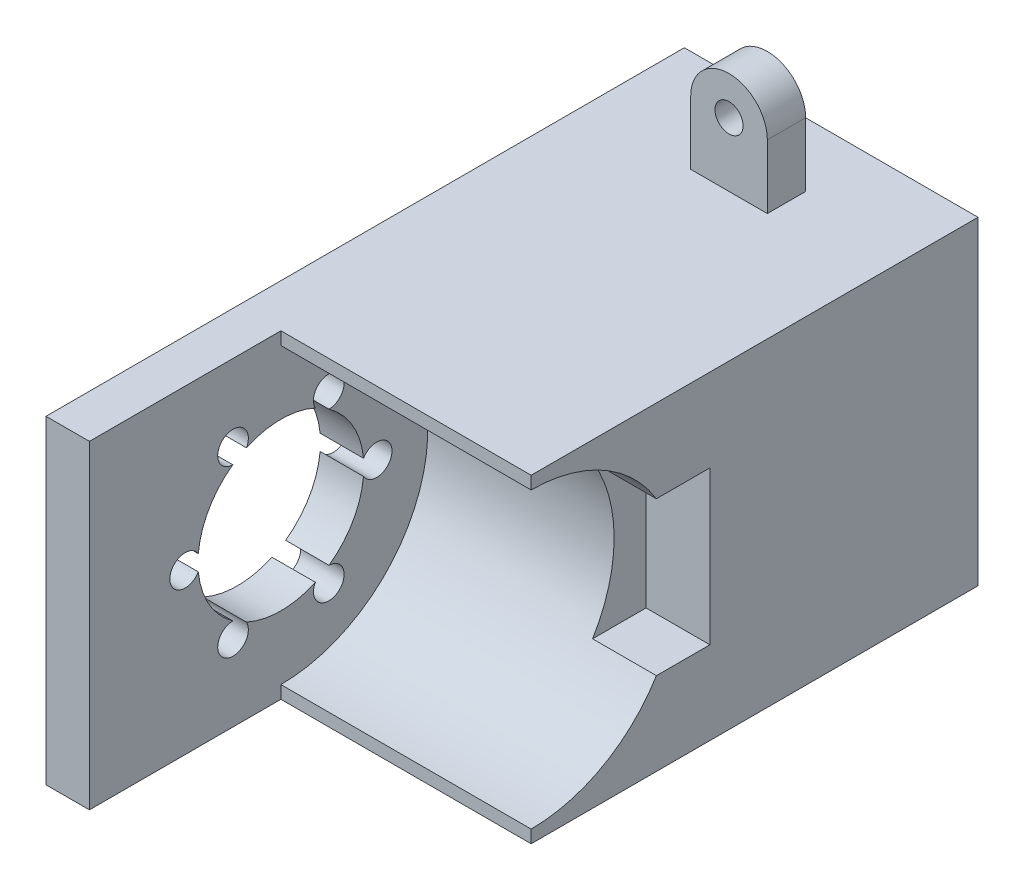
from build123d import *

# Parameters (mm, degrees)
SKETCH_1_W          = 23
SKETCH_1_H          = 25
EXTRUDE_1_DEPTH     = 35
SKETCH_2_W          = 19.6
SKETCH_2_H          = 11.5
SKETCH_4_W          = 3.4
SKETCH_4_H          = 25
EXTRUDE_2_DEPTH     = 15
CUT_EXTRUDE_1_DEPTH = 4
SKETCH_7_W          = 5
SKETCH_7_H          = 12
CUT_EXTRUDE_3_DEPTH = 5
SKETCH_8_R          = 1.1
EXTRUDE_3_DEPTH     = 8
SKETCH_8_2_R        = 1.1
CUT_EXTRUDE_4_DEPTH = 5


with BuildPart() as part:
    # 草图1 → 凸台-拉伸1 (new body)
    with BuildSketch(Plane.XY):
        Rectangle(SKETCH_1_W, SKETCH_1_H)
    extrude(amount=-EXTRUDE_1_DEPTH)

    # 草图2 → 切除-旋转2 (revolve, cut)
    with BuildSketch(Plane.XY):
        with Locations((1.7, -5.75)):
            Rectangle(SKETCH_2_W, SKETCH_2_H)
    revolve(axis=Axis((11.5, 0, 0), (-1, 0, 0)), mode=Mode.SUBTRACT)

    # 草图4 → 凸台-拉伸2 (add)
    with BuildSketch(Plane.XY):
        with Locations((-9.8, 0)):
            Rectangle(SKETCH_4_W, SKETCH_4_H)
    extrude(amount=EXTRUDE_2_DEPTH)

    # 草图6 → 切除-拉伸1 (cut)
    with BuildSketch(Plane(origin=(-8.1, 0, 0), x_dir=(0, 0, -1), z_dir=(1, 0, 0))):
        with BuildLine():
            ThreePointArc((6.470666667, -0.616824845), (8.7, 0), (6.470666667, 0.616824845))
            ThreePointArc((6.470666667, 0.616824845), (5.629165125, 3.25), (3.769519318, 5.29534929))
            ThreePointArc((3.769519318, 5.29534929), (4.35, 7.534421013), (2.701147348, 5.912174135))
            ThreePointArc((2.701147348, 5.912174135), (0, 6.5), (-2.701147348, 5.912174135))
            ThreePointArc((-2.701147348, 5.912174135), (-4.35, 7.534421013), (-3.769519318, 5.29534929))
            ThreePointArc((-3.769519318, 5.29534929), (-5.629165125, 3.25), (-6.470666667, 0.616824845))
            ThreePointArc((-6.470666667, 0.616824845), (-8.7, 0), (-6.470666667, -0.616824845))
            ThreePointArc((-6.470666667, -0.616824845), (-5.629165125, -3.25), (-3.769519318, -5.29534929))
            ThreePointArc((-3.769519318, -5.29534929), (-4.35, -7.534421013), (-2.701147348, -5.912174135))
            ThreePointArc((-2.701147348, -5.912174135), (0, -6.5), (2.701147348, -5.912174135))
            ThreePointArc((2.701147348, -5.912174135), (4.35, -7.534421013), (3.769519318, -5.29534929))
            ThreePointArc((3.769519318, -5.29534929), (5.629165125, -3.25), (6.470666667, -0.616824845))
        make_face()
    extrude(amount=-CUT_EXTRUDE_1_DEPTH, mode=Mode.SUBTRACT)

    # 草图7 → 切除-拉伸3 (cut)
    with BuildSketch(Plane(origin=(11.5, 0, 0), x_dir=(0, 0, -1), z_dir=(1, 0, 0))):
        with Locations((11.5, 0)):
            Rectangle(SKETCH_7_W, SKETCH_7_H)
    extrude(amount=-CUT_EXTRUDE_3_DEPTH, mode=Mode.SUBTRACT)

    # 草图8 → 凸台-拉伸3 (add)
    # profile 1 of 2: a face of its own
    with BuildSketch(Plane(origin=(0, 0, -35), x_dir=(-1, 0, 0), z_dir=(0, 0, -1))):
        with BuildLine():
            Line((3, 17.5), (3, 12.5))
            Line((3, 12.5), (-3, 12.5))
            Line((-3, 12.5), (-3, 17.5))
            ThreePointArc((-3, 17.5), (0, 20.5), (3, 17.5))
        make_face()
        with Locations((0, 17.5)):
            Circle(SKETCH_8_R, mode=Mode.SUBTRACT)
    # profile 2 of 2: a face of its own
    with BuildSketch(Plane(origin=(0, 0, -35), x_dir=(-1, 0, 0), z_dir=(0, 0, -1))):
        with BuildLine():
            Line((-3, -17.5), (-3, -12.5))
            Line((-3, -12.5), (3, -12.5))
            Line((3, -12.5), (3, -17.5))
            ThreePointArc((3, -17.5), (0, -20.5), (-3, -17.5))
        make_face()
        with Locations((0, -17.5)):
            Circle(SKETCH_8_R, mode=Mode.SUBTRACT)
    extrude(amount=-EXTRUDE_3_DEPTH)

    # 草图8<2> → 切除-拉伸4 (cut)
    # profile 1 of 2: a face of its own
    with BuildSketch(Plane(origin=(0, 0, -35), x_dir=(-1, 0, 0), z_dir=(0, 0, -1))):
        with BuildLine():
            Line((3, 17.5), (3, 12.5))
            Line((3, 12.5), (-3, 12.5))
            Line((-3, 12.5), (-3, 17.5))
            ThreePointArc((-3, 17.5), (0, 20.5), (3, 17.5))
        make_face()
        with Locations((0, 17.5)):
            Circle(SKETCH_8_2_R, mode=Mode.SUBTRACT)
    # profile 2 of 2: a face of its own
    with BuildSketch(Plane(origin=(0, 0, -35), x_dir=(-1, 0, 0), z_dir=(0, 0, -1))):
        with BuildLine():
            Line((-3, -17.5), (-3, -12.5))
            Line((-3, -12.5), (3, -12.5))
            Line((3, -12.5), (3, -17.5))
            ThreePointArc((3, -17.5), (0, -20.5), (-3, -17.5))
        make_face()
        with Locations((0, -17.5)):
            Circle(SKETCH_8_2_R, mode=Mode.SUBTRACT)
    extrude(amount=-CUT_EXTRUDE_4_DEPTH, mode=Mode.SUBTRACT)


solid = part.part
